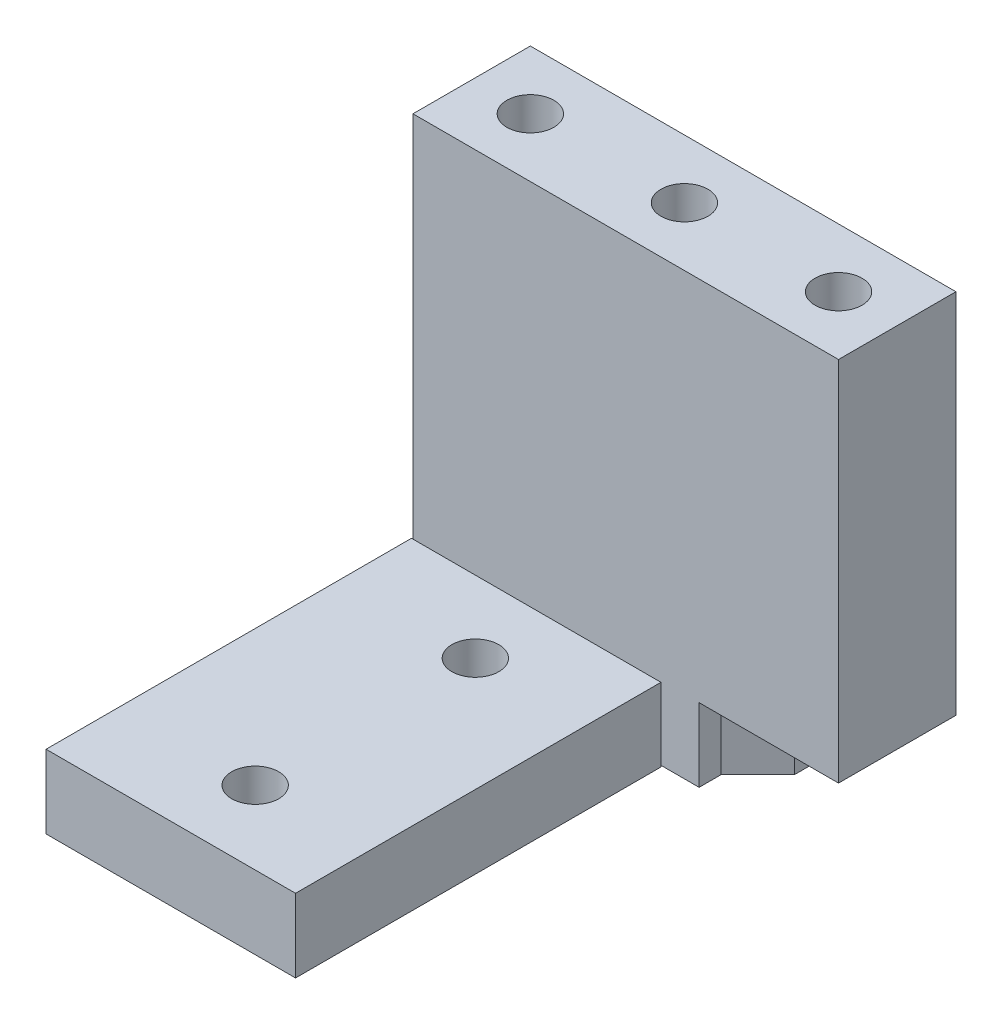
from build123d import *

# Parameters (mm, degrees)
EXTRUDE_1_DEPTH          = 8
CUT_EXTRUDE_1_DEPTH      = 35.267331381
CUT_EXTRUDE_1_DEPTH_BACK = 35.267331381
SKETCH_3_R               = 1.6
EXTRUDE_2_REACH          = 36.267
SKETCH_5_W               = 17
SKETCH_5_H               = 25
SKETCH_8_W               = 20
SKETCH_8_H               = 13.304516949
EXTRUDE_4_DEPTH          = 1.5
CUT_EXTRUDE_4_DEPTH      = 5
SKETCH_10_R              = 1.6
SKETCH_10_W              = 17
SKETCH_10_H              = 0.1
CUT_EXTRUDE_5_DEPTH      = 10
FILLET_1_R               = 0.2


with BuildPart() as part:
    # 草图2 → 凸台-拉伸1 (new body)
    with BuildSketch(Plane.XY):
        Polygon((14.5, 15), (-14.5, 15), (-14.5, -15), (7.5, -15), (7.5, -10), (14.5, -10), align=None)
        with BuildLine():
            Line((2.9, -9.46), (2.9, -4.54))
            Line((2.9, -4.54), (-7.05, -4.54))
            Line((-7.05, -4.54), (-7.05, -3.69))
            Line((-7.05, -3.69), (2.75, -3.69))
            ThreePointArc((2.75, -3.69), (3.25, -3.19), (3.75, -3.69))
            Line((3.75, -3.69), (3.75, -10.31))
            ThreePointArc((3.75, -10.31), (3.25, -10.81), (2.75, -10.31))
            Line((2.75, -10.31), (-7.05, -10.31))
            Line((-7.05, -10.31), (-7.05, -9.46))
            Line((-7.05, -9.46), (2.9, -9.46))
        make_face(mode=Mode.SUBTRACT)
    extrude(amount=EXTRUDE_1_DEPTH)

    # 草图3 → 切除-拉伸1 (cut, two sides: drawn at the far end of the back side and taken through both)
    with BuildSketch(Plane(origin=(0, 15, 0), x_dir=(1, 0, 0), z_dir=(0, 1, 0)).offset(-CUT_EXTRUDE_1_DEPTH_BACK)):
        with Locations(Location((0, -4, 0), (0, 0, 270))):
            Circle(SKETCH_3_R)
        with Locations(Location((10.5, -4, 0), (0, 0, 270))):
            Circle(SKETCH_3_R)
        with Locations(Location((-10.5, -4, 0), (0, 0, 270))):
            Circle(SKETCH_3_R)
    extrude(amount=CUT_EXTRUDE_1_DEPTH + CUT_EXTRUDE_1_DEPTH_BACK, mode=Mode.SUBTRACT)

    # 凸台-拉伸2: up to this face of the body (flat: up to its plane)
    extrude_2_end = Plane(part.part.faces().sort_by_distance((7.606301458, -10, 4))[0])
    # 草图5 → 凸台-拉伸2 (add, up to the picked face)
    with BuildSketch(Plane.XZ.offset(15), mode=Mode.PRIVATE) as extrude_2_sk1:
        with Locations((-6, 20.5)):
            Rectangle(SKETCH_5_W, SKETCH_5_H)
    extrude_2_tool1 = split(extrude(extrude_2_sk1.sketch, amount=-EXTRUDE_2_REACH, mode=Mode.PRIVATE), bisect_by=extrude_2_end, keep=Keep.BOTH, mode=Mode.PRIVATE)
    add(extrude_2_tool1.solids().sort_by(Axis((-6, -15, 20.5), (0, 1, 0)))[0])

    # 草图8 → 凸台-拉伸4 (add)
    with BuildSketch(Plane.XY.offset(8)):
        with Locations((-2.5, -8.347741526)):
            Rectangle(SKETCH_8_W, SKETCH_8_H)
    extrude(amount=-EXTRUDE_4_DEPTH)

    # 草图9 → 切除-拉伸4 (cut)
    with BuildSketch(Plane.XZ.offset(15)):
        Polygon((5, 6.5), (7.5, 4), (7.5, 8), (5, 8), align=None)
    extrude(amount=-CUT_EXTRUDE_4_DEPTH, mode=Mode.SUBTRACT)

    # 草图10 → 切除-拉伸5 (cut)
    with BuildSketch(Plane.XZ.offset(15)):
        with Locations((-5.25, 13)):
            Circle(SKETCH_10_R)
        with Locations((-5.25, 28)):
            Circle(SKETCH_10_R)
        with Locations((-6, 8.05)):
            Rectangle(SKETCH_10_W, SKETCH_10_H)
    extrude(amount=-CUT_EXTRUDE_5_DEPTH, mode=Mode.SUBTRACT)


with BuildPart() as cut_extrude_5_piece_1:
    # of the separate pieces the step leaves, piece 1, a body of its own (cut_extrude_5_pieces)
    add(part.part.solids().sort_by_distance((-14.5, -15, 0))[0])

    # 圆角1
    fillet_1_edges = [cut_extrude_5_piece_1.edges().sort_by_distance(p)[0] for p in [
        (2.9, -9.46, 3.25),
        (2.9, -4.54, 3.25),
    ]]
    fillet(fillet_1_edges, radius=FILLET_1_R)


with BuildPart() as cut_extrude_5_piece_2:
    # of the separate pieces the step leaves, piece 2, a body of its own (cut_extrude_5_pieces)
    add(part.part.solids().sort_by_distance((-14.5, -15, 8.1))[0])


solid = Compound([cut_extrude_5_piece_1.part, cut_extrude_5_piece_2.part])
